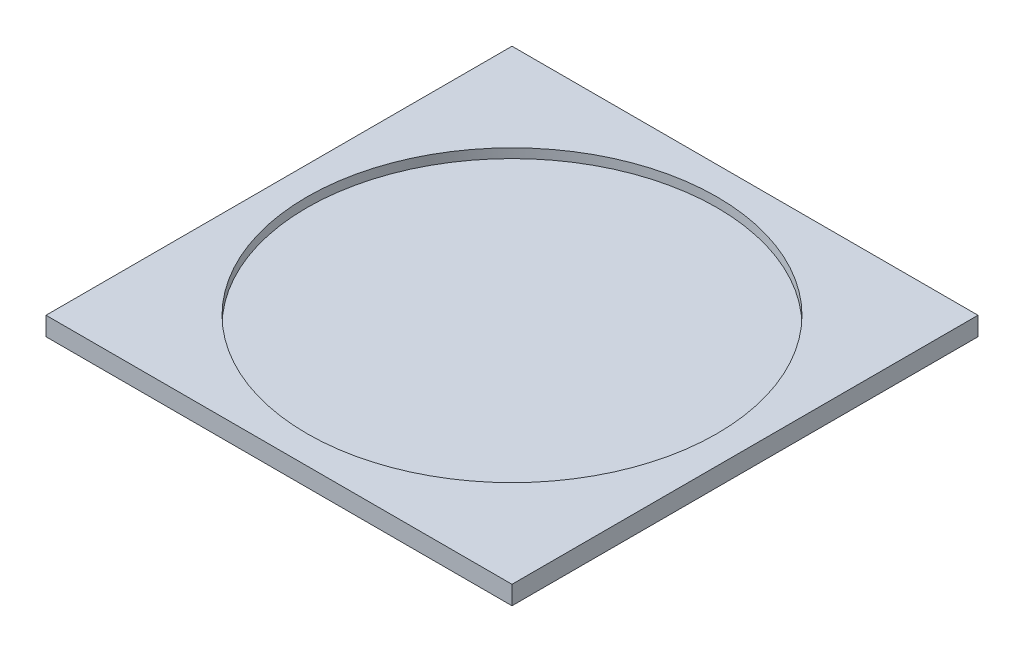
from build123d import *

# Parameters (mm, degrees)
SKETCH1_W           = 250
SKETCH1_H           = 250
BOSS_EXTRUDE1_DEPTH = 10
SKETCH2_R           = 110
CUT_EXTRUDE1_DEPTH  = 5


with BuildPart() as part:
    # Sketch1 → Boss-Extrude1 (new body)
    with BuildSketch(Plane(origin=(0, 0, 0), x_dir=(1, 0, 0), z_dir=(0, 1, 0))):
        Rectangle(SKETCH1_W, SKETCH1_H)
    extrude(amount=BOSS_EXTRUDE1_DEPTH)

    # Sketch2 → Cut-Extrude1 (cut)
    with BuildSketch(Plane(origin=(0, 10, 0), x_dir=(1, 0, 0), z_dir=(0, 1, 0))):
        with Locations(Location((0, 0, 0), (0, 0, 270))):
            Circle(SKETCH2_R)
    extrude(amount=-CUT_EXTRUDE1_DEPTH, mode=Mode.SUBTRACT)


solid = part.part
